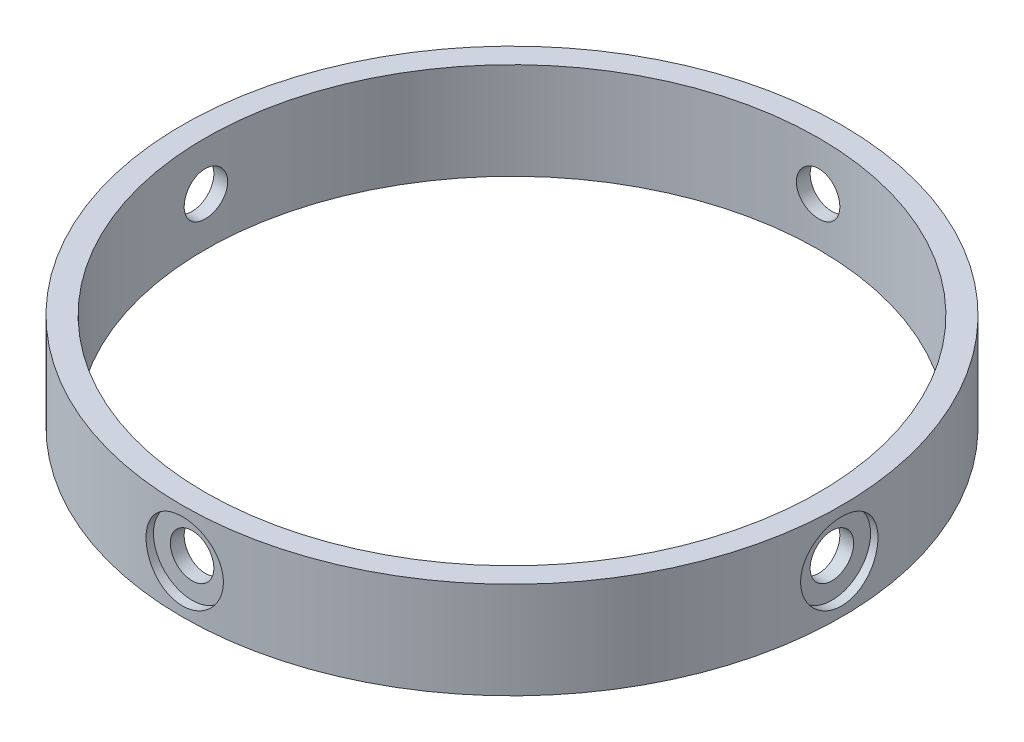
from build123d import *

# Parameters (mm, degrees)
SKETCH1_R               = 34.1
SKETCH1_R_2             = 31.75
BOSS_EXTRUDE1_DEPTH     = 5
SKETCH2_R               = 4
CUT_EXTRUDE1_DEPTH      = 1
CUT_EXTRUDE2_REACH      = 77.523
CUT_EXTRUDE2_END_RADIUS = 31.75
SKETCH3_R               = 2.25
CIRPATTERN1_COUNT       = 4


with BuildPart() as part:
    # Sketch1 → Boss-Extrude1 (new, symmetric)
    with BuildSketch(Plane(origin=(0, 0, 0), x_dir=(1, 0, 0), z_dir=(0, 1, 0))):
        with Locations(Location((0, 0, 0), (0, 0, 270))):
            Circle(SKETCH1_R)
        with Locations(Location((0, 0, 0), (0, 0, 270))):
            Circle(SKETCH1_R_2, mode=Mode.SUBTRACT)
    extrude(amount=BOSS_EXTRUDE1_DEPTH, both=True)

    # Sketch2 → Cut-Extrude1 (cut)
    with BuildSketch(Plane(origin=(0, 0, -34.1), x_dir=(-1, 0, 0), z_dir=(0, 0, -1))):
        Circle(SKETCH2_R)
    cut_extrude1 = extrude(amount=-CUT_EXTRUDE1_DEPTH, mode=Mode.SUBTRACT)

    # Cut-Extrude2: up to this cylinder (the profile starts outside it)
    cut_extrude2_end = Plane(origin=(0, 0, 0), z_dir=(0, -1, 0)) * Cylinder(CUT_EXTRUDE2_END_RADIUS, 219.546, mode=Mode.PRIVATE)
    # Sketch3 → Cut-Extrude2 (cut, up to the surface)
    with BuildSketch(Plane(origin=(0, 0, -33.1), x_dir=(-1, 0, 0), z_dir=(0, 0, -1)), mode=Mode.PRIVATE) as cut_extrude2_sk1:
        Circle(SKETCH3_R)
    cut_extrude2_tool1 = extrude(cut_extrude2_sk1.sketch, amount=-CUT_EXTRUDE2_REACH, mode=Mode.PRIVATE) - cut_extrude2_end
    cut_extrude2 = cut_extrude2_tool1.solids().sort_by_distance((0, 0, -33.1))[0]
    add(cut_extrude2, mode=Mode.SUBTRACT)

    # CirPattern1: Cut-Extrude1, Cut-Extrude2 ×4 about axis
    cirpattern1_axis = Axis((0, 0, 0), (0, 1, 0))
    add([cut_extrude1.rotate(cirpattern1_axis, i * 360 / CIRPATTERN1_COUNT) for i in range(1, CIRPATTERN1_COUNT)], mode=Mode.SUBTRACT)
    add([cut_extrude2.rotate(cirpattern1_axis, i * 360 / CIRPATTERN1_COUNT) for i in range(1, CIRPATTERN1_COUNT)], mode=Mode.SUBTRACT)


solid = part.part
